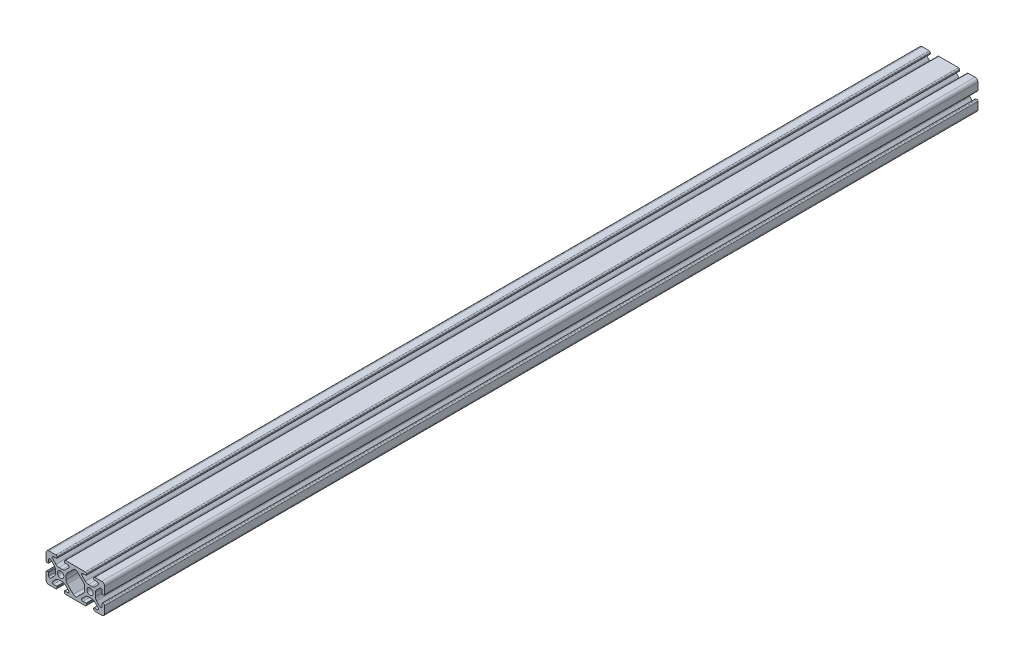
from build123d import *

# Parameters (mm, degrees)
ESQUISSE1_R        = 2.15
BOSS_EXTRU_1_DEPTH = 297.5


with BuildPart() as part:
    # Esquisse1 → Boss.-Extru.1 (new, symmetric)
    with BuildSketch(Plane(origin=(0, 0, 0), x_dir=(-1, 0, 0), z_dir=(0, 0, -1))):
        with BuildLine():
            Line((-40, 6.7), (-40, 2))
            ThreePointArc((-40, 2), (-39.414213562, 0.585786438), (-38, 0))
            Line((-38, 0), (-33.3, 0))
            ThreePointArc((-33.3, 0), (-32.734314575, 0.234314575), (-32.5, 0.8))
            Line((-32.5, 0.8), (-32.5, 1.5))
            ThreePointArc((-32.5, 1.5), (-32.587867966, 1.712132034), (-32.8, 1.8))
            Line((-32.8, 1.8), (-34.918424061, 1.8))
            ThreePointArc((-34.918424061, 1.8), (-35.686700051, 2.313345604), (-35.506437047, 3.219588924))
            Line((-35.506437047, 3.219588924), (-33.254705627, 5.471320344))
            ThreePointArc((-33.254705627, 5.471320344), (-32.281435581, 6.121638598), (-31.133385284, 6.35))
            Line((-31.133385284, 6.35), (-28.866614716, 6.35))
            ThreePointArc((-28.866614716, 6.35), (-27.718564419, 6.121638598), (-26.745294373, 5.471320344))
            Line((-26.745294373, 5.471320344), (-24.493562953, 3.219588924))
            ThreePointArc((-24.493562953, 3.219588924), (-24.313299949, 2.313345604), (-25.081575939, 1.8))
            Line((-25.081575939, 1.8), (-27.2, 1.8))
            ThreePointArc((-27.2, 1.8), (-27.412132034, 1.712132034), (-27.5, 1.5))
            Line((-27.5, 1.5), (-27.5, 0.8))
            ThreePointArc((-27.5, 0.8), (-27.265685425, 0.234314575), (-26.7, 0))
            Line((-26.7, 0), (-13.3, 0))
            ThreePointArc((-13.3, 0), (-12.734314575, 0.234314575), (-12.5, 0.8))
            Line((-12.5, 0.8), (-12.5, 1.5))
            ThreePointArc((-12.5, 1.5), (-12.587867966, 1.712132034), (-12.8, 1.8))
            Line((-12.8, 1.8), (-14.918424061, 1.8))
            ThreePointArc((-14.918424061, 1.8), (-15.686700051, 2.313345604), (-15.506437047, 3.219588924))
            Line((-15.506437047, 3.219588924), (-13.254705627, 5.471320344))
            ThreePointArc((-13.254705627, 5.471320344), (-12.281435581, 6.121638598), (-11.133385284, 6.35))
            Line((-11.133385284, 6.35), (-8.866614716, 6.35))
            ThreePointArc((-8.866614716, 6.35), (-7.718564419, 6.121638598), (-6.745294373, 5.471320344))
            Line((-6.745294373, 5.471320344), (-4.493562953, 3.219588924))
            ThreePointArc((-4.493562953, 3.219588924), (-4.313299949, 2.313345604), (-5.081575939, 1.8))
            Line((-5.081575939, 1.8), (-7.2, 1.8))
            ThreePointArc((-7.2, 1.8), (-7.412132034, 1.712132034), (-7.5, 1.5))
            Line((-7.5, 1.5), (-7.5, 0.8))
            ThreePointArc((-7.5, 0.8), (-7.265685425, 0.234314575), (-6.7, 0))
            Line((-6.7, 0), (-2, 0))
            ThreePointArc((-2, 0), (-0.585786438, 0.585786438), (0, 2))
            Line((0, 2), (0, 6.7))
            ThreePointArc((0, 6.7), (-0.234314575, 7.265685425), (-0.8, 7.5))
            Line((-0.8, 7.5), (-1.5, 7.5))
            ThreePointArc((-1.5, 7.5), (-1.712132034, 7.412132034), (-1.8, 7.2))
            Line((-1.8, 7.2), (-1.8, 5.081575939))
            ThreePointArc((-1.8, 5.081575939), (-2.313345604, 4.313299949), (-3.219588924, 4.493562953))
            Line((-3.219588924, 4.493562953), (-5.471320344, 6.745294373))
            ThreePointArc((-5.471320344, 6.745294373), (-6.121638598, 7.718564419), (-6.35, 8.866614716))
            Line((-6.35, 8.866614716), (-6.35, 11.133385284))
            ThreePointArc((-6.35, 11.133385284), (-6.121638598, 12.281435581), (-5.471320344, 13.254705627))
            Line((-5.471320344, 13.254705627), (-3.219588924, 15.506437047))
            ThreePointArc((-3.219588924, 15.506437047), (-2.313345604, 15.686700051), (-1.8, 14.918424061))
            Line((-1.8, 14.918424061), (-1.8, 12.8))
            ThreePointArc((-1.8, 12.8), (-1.712132034, 12.587867966), (-1.5, 12.5))
            Line((-1.5, 12.5), (-0.8, 12.5))
            ThreePointArc((-0.8, 12.5), (-0.234314575, 12.734314575), (0, 13.3))
            Line((0, 13.3), (0, 18))
            ThreePointArc((0, 18), (-0.585786438, 19.414213562), (-2, 20))
            Line((-2, 20), (-6.7, 20))
            ThreePointArc((-6.7, 20), (-7.265685425, 19.765685425), (-7.5, 19.2))
            Line((-7.5, 19.2), (-7.5, 18.5))
            ThreePointArc((-7.5, 18.5), (-7.412132034, 18.287867966), (-7.2, 18.2))
            Line((-7.2, 18.2), (-5.081575939, 18.2))
            ThreePointArc((-5.081575939, 18.2), (-4.313299949, 17.686654396), (-4.493562953, 16.780411076))
            Line((-4.493562953, 16.780411076), (-6.745294373, 14.528679656))
            ThreePointArc((-6.745294373, 14.528679656), (-7.718564419, 13.878361402), (-8.866614716, 13.65))
            Line((-8.866614716, 13.65), (-11.133385284, 13.65))
            ThreePointArc((-11.133385284, 13.65), (-12.281435581, 13.878361402), (-13.254705627, 14.528679656))
            Line((-13.254705627, 14.528679656), (-15.506437047, 16.780411076))
            ThreePointArc((-15.506437047, 16.780411076), (-15.686700051, 17.686654396), (-14.918424061, 18.2))
            Line((-14.918424061, 18.2), (-12.8, 18.2))
            ThreePointArc((-12.8, 18.2), (-12.587867966, 18.287867966), (-12.5, 18.5))
            Line((-12.5, 18.5), (-12.5, 19.2))
            ThreePointArc((-12.5, 19.2), (-12.734314575, 19.765685425), (-13.3, 20))
            Line((-13.3, 20), (-26.7, 20))
            ThreePointArc((-26.7, 20), (-27.265685425, 19.765685425), (-27.5, 19.2))
            Line((-27.5, 19.2), (-27.5, 18.5))
            ThreePointArc((-27.5, 18.5), (-27.412132034, 18.287867966), (-27.2, 18.2))
            Line((-27.2, 18.2), (-25.081575939, 18.2))
            ThreePointArc((-25.081575939, 18.2), (-24.313299949, 17.686654396), (-24.493562953, 16.780411076))
            Line((-24.493562953, 16.780411076), (-26.745294373, 14.528679656))
            ThreePointArc((-26.745294373, 14.528679656), (-27.718564419, 13.878361402), (-28.866614716, 13.65))
            Line((-28.866614716, 13.65), (-31.133385284, 13.65))
            ThreePointArc((-31.133385284, 13.65), (-32.281435581, 13.878361402), (-33.254705627, 14.528679656))
            Line((-33.254705627, 14.528679656), (-35.506437047, 16.780411076))
            ThreePointArc((-35.506437047, 16.780411076), (-35.686700051, 17.686654396), (-34.918424061, 18.2))
            Line((-34.918424061, 18.2), (-32.8, 18.2))
            ThreePointArc((-32.8, 18.2), (-32.587867966, 18.287867966), (-32.5, 18.5))
            Line((-32.5, 18.5), (-32.5, 19.2))
            ThreePointArc((-32.5, 19.2), (-32.734314575, 19.765685425), (-33.3, 20))
            Line((-33.3, 20), (-38, 20))
            ThreePointArc((-38, 20), (-39.414213562, 19.414213562), (-40, 18))
            Line((-40, 18), (-40, 13.3))
            ThreePointArc((-40, 13.3), (-39.765685425, 12.734314575), (-39.2, 12.5))
            Line((-39.2, 12.5), (-38.5, 12.5))
            ThreePointArc((-38.5, 12.5), (-38.287867966, 12.587867966), (-38.2, 12.8))
            Line((-38.2, 12.8), (-38.2, 14.918424061))
            ThreePointArc((-38.2, 14.918424061), (-37.686654396, 15.686700051), (-36.780411076, 15.506437047))
            Line((-36.780411076, 15.506437047), (-34.528679656, 13.254705627))
            ThreePointArc((-34.528679656, 13.254705627), (-33.878361402, 12.281435581), (-33.65, 11.133385284))
            Line((-33.65, 11.133385284), (-33.65, 8.866614716))
            ThreePointArc((-33.65, 8.866614716), (-33.878361402, 7.718564419), (-34.528679656, 6.745294373))
            Line((-34.528679656, 6.745294373), (-36.780411076, 4.493562953))
            ThreePointArc((-36.780411076, 4.493562953), (-37.686654396, 4.313299949), (-38.2, 5.081575939))
            Line((-38.2, 5.081575939), (-38.2, 7.2))
            ThreePointArc((-38.2, 7.2), (-38.287867966, 7.412132034), (-38.5, 7.5))
            Line((-38.5, 7.5), (-39.2, 7.5))
            ThreePointArc((-39.2, 7.5), (-39.765685425, 7.265685425), (-40, 6.7))
        make_face()
        with Locations(Location((-10, 10, 0), (0, 0, 180))):
            Circle(ESQUISSE1_R, mode=Mode.SUBTRACT)
        with Locations(Location((-30, 10, 0), (0, 0, 180))):
            Circle(ESQUISSE1_R, mode=Mode.SUBTRACT)
        with BuildLine():
            Line((-18.585786174, 17.312993861), (-14.528681072, 13.255889759))
            ThreePointArc((-14.528681072, 13.255889759), (-13.878362627, 12.282619622), (-13.650001154, 11.134569154))
            Line((-13.650001154, 11.134569154), (-13.650001154, 8.865431094))
            ThreePointArc((-13.650001154, 8.865431094), (-13.878362476, 7.717381202), (-14.5286805, 6.7441115))
            Line((-14.5286805, 6.7441115), (-18.585786, 2.687006))
            ThreePointArc((-18.585786, 2.687006), (-19.999999562, 2.101219562), (-21.414213125, 2.687006))
            Line((-21.414213125, 2.687006), (-25.471320125, 6.744113))
            ThreePointArc((-25.471320125, 6.744113), (-26.121638379, 7.717383046), (-26.349999781, 8.865433344))
            Line((-26.349999781, 8.865433344), (-26.349999781, 11.134567344))
            ThreePointArc((-26.349999781, 11.134567344), (-26.121638308, 12.282617811), (-25.471319863, 13.255887949))
            Line((-25.471319863, 13.255887949), (-21.41421295, 17.312993861))
            ThreePointArc((-21.41421295, 17.312993861), (-19.999999562, 17.898780125), (-18.585786174, 17.312993861))
        make_face(mode=Mode.SUBTRACT)
    extrude(amount=BOSS_EXTRU_1_DEPTH, both=True)


solid = part.part
